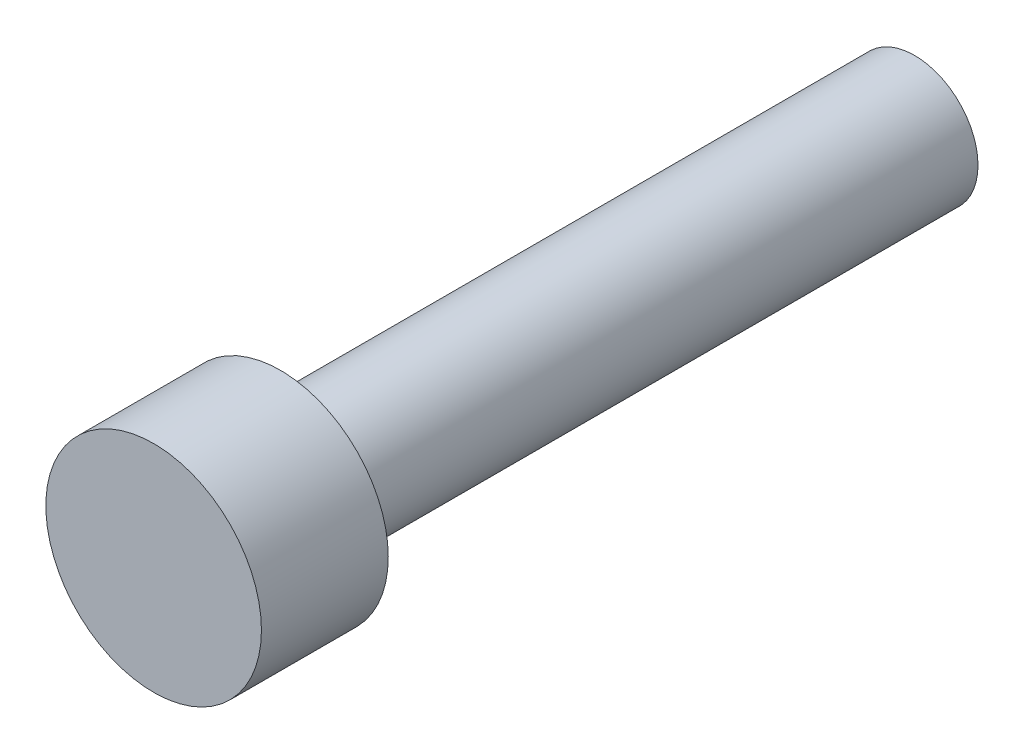
from build123d import *


with BuildPart() as part:
    # 草图1 → 旋转1 (revolve)
    with BuildSketch(Plane(origin=(0, 0, 0), x_dir=(0, 0, -1), z_dir=(1, 0, 0)), mode=Mode.PRIVATE) as revolve_1_sk:
        Polygon((25, 0), (25, 2.5), (0, 2.5), (0, 4.25), (-5, 4.25), (-5, 0), align=None)
    revolve(revolve_1_sk.sketch.rotate(Axis((0, 0, 10), (0, 0, -1)), 90), axis=Axis((0, 0, 10), (0, 0, -1)))


solid = part.part
